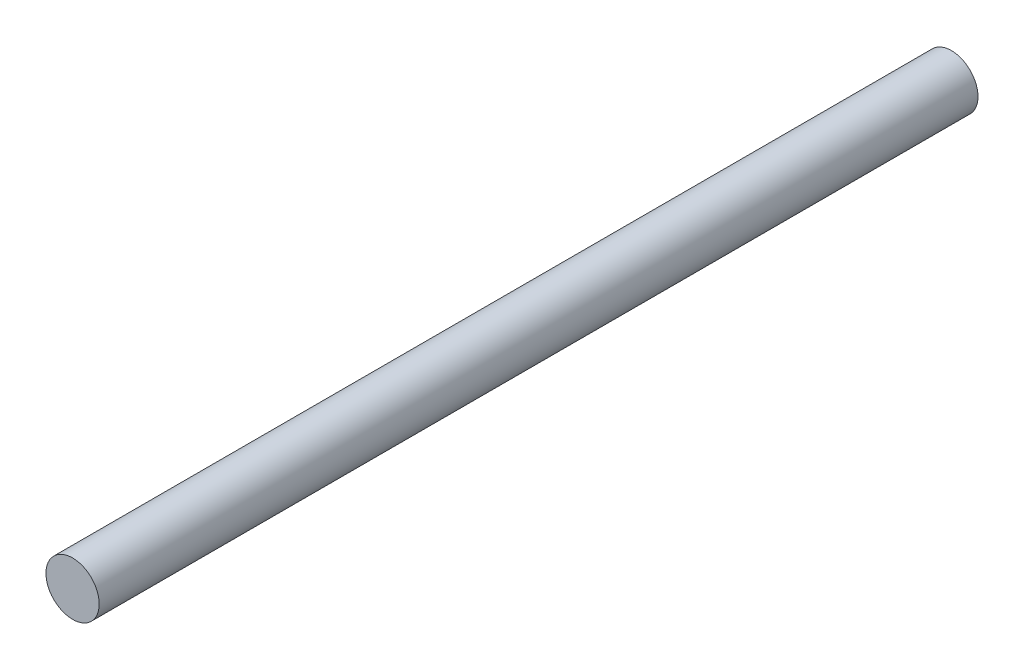
from build123d import *

# Parameters (mm, degrees)
SKETCH1_R           = 2
BOSS_EXTRUDE1_DEPTH = 66


with BuildPart() as part:
    # Sketch1 → Boss-Extrude1 (new body)
    with BuildSketch(Plane.XY):
        Circle(SKETCH1_R)
    extrude(amount=BOSS_EXTRUDE1_DEPTH)


solid = part.part
